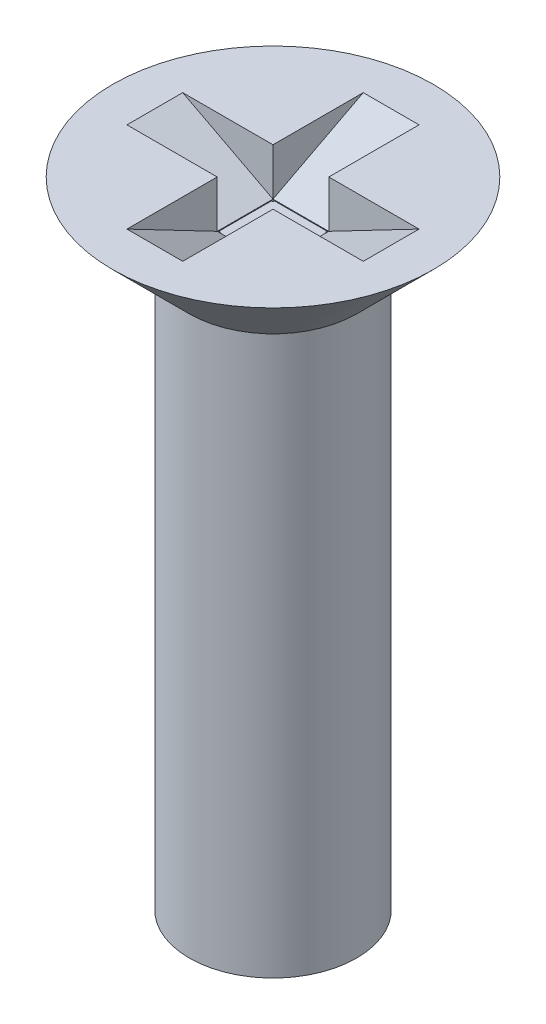
from build123d import *

# Parameters (mm, degrees)
CUT_EXTRUDE1_DEPTH = 0.5
CIRPATTERN1_COUNT  = 4


with BuildPart() as part:
    # Sketch1 → Revolve1 (revolve)
    with BuildSketch(Plane.XY):
        Polygon((-1.5, 0), (-1.5, -10), (0, -10), (0, 1.375), (-2.875, 1.375), align=None)
    revolve(axis=Axis((0, 0, 0), (0, -1, 0)))

    # Sketch2 → Cut-Extrude1 (cut, symmetric)
    with BuildSketch(Plane.XY):
        Polygon((-2.11777299, 1.375), (2.11777299, 1.375), (0.472629215, 0.516963183), (-0.472629215, 0.516963183), align=None)
    cut_extrude1 = extrude(amount=CUT_EXTRUDE1_DEPTH, both=True, mode=Mode.SUBTRACT)

    # CirPattern1: Cut-Extrude1 ×4 about axis
    cirpattern1_axis = Axis((0, 0, 0), (0, 1, 0))
    for i in range(1, CIRPATTERN1_COUNT):
        add(cut_extrude1.rotate(cirpattern1_axis, i * 360 / CIRPATTERN1_COUNT), mode=Mode.SUBTRACT)


solid = part.part
